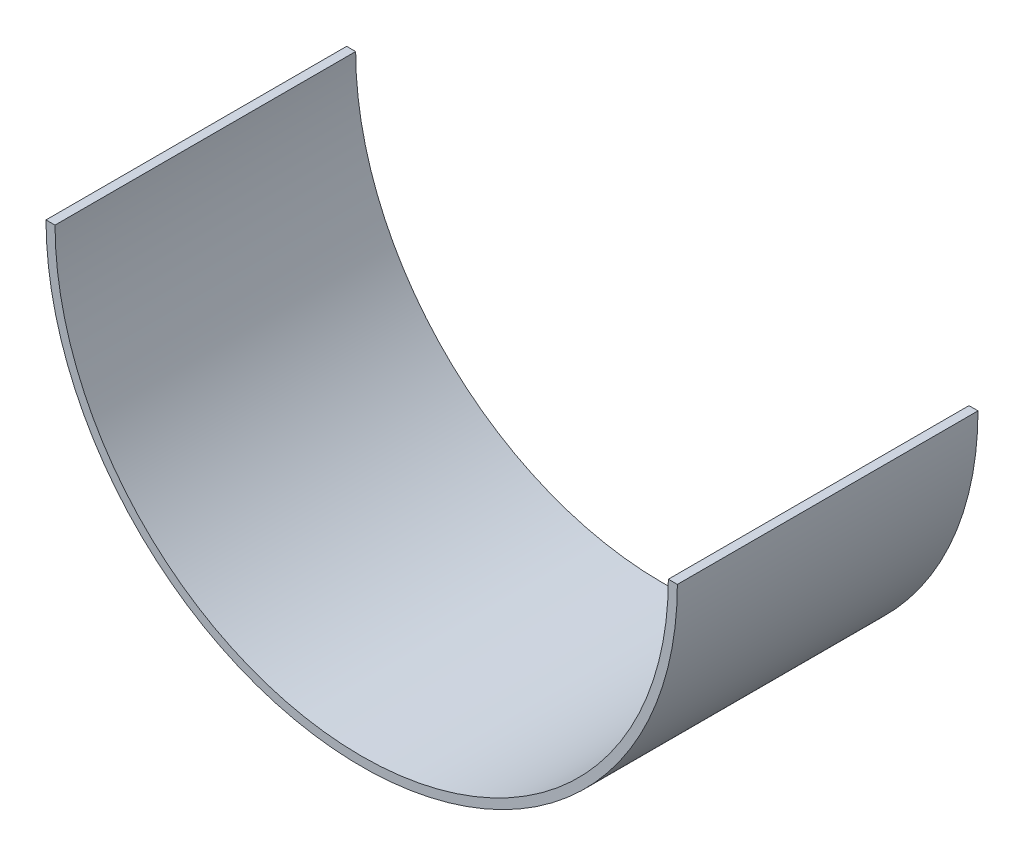
from build123d import *

# Parameters (mm, degrees)
ESQUISSE1_R             = 52.5
BOSS_EXTRU_1_DEPTH      = 50
ESQUISSE2_R             = 51
ENL_V_MAT_EXTRU_1_DEPTH = 90.51256895
ENL_V_MAT_EXTRU_2_DEPTH = 90.51256895


with BuildPart() as part:
    # Esquisse1 → Boss.-Extru.1 (new body)
    with BuildSketch(Plane.XY):
        Circle(ESQUISSE1_R)
    extrude(amount=BOSS_EXTRU_1_DEPTH)

    # Esquisse2 → Enlèv. mat.-Extru.1 (cut, through all)
    with BuildSketch(Plane.XY.offset(50)):
        Circle(ESQUISSE2_R)
    extrude(amount=-ENL_V_MAT_EXTRU_1_DEPTH, mode=Mode.SUBTRACT)

    # Esquisse3 → Enlèv. mat.-Extru.2 (cut, through all)
    with BuildSketch(Plane.XY.offset(50)):
        Polygon((-297.287137637, 0), (-52.5, 0), (52.5, 0), (297.287137637, 0), (297.287137637, 489.574275275), (-297.287137637, 489.574275275), align=None)
    extrude(amount=-ENL_V_MAT_EXTRU_2_DEPTH, mode=Mode.SUBTRACT)


solid = part.part
